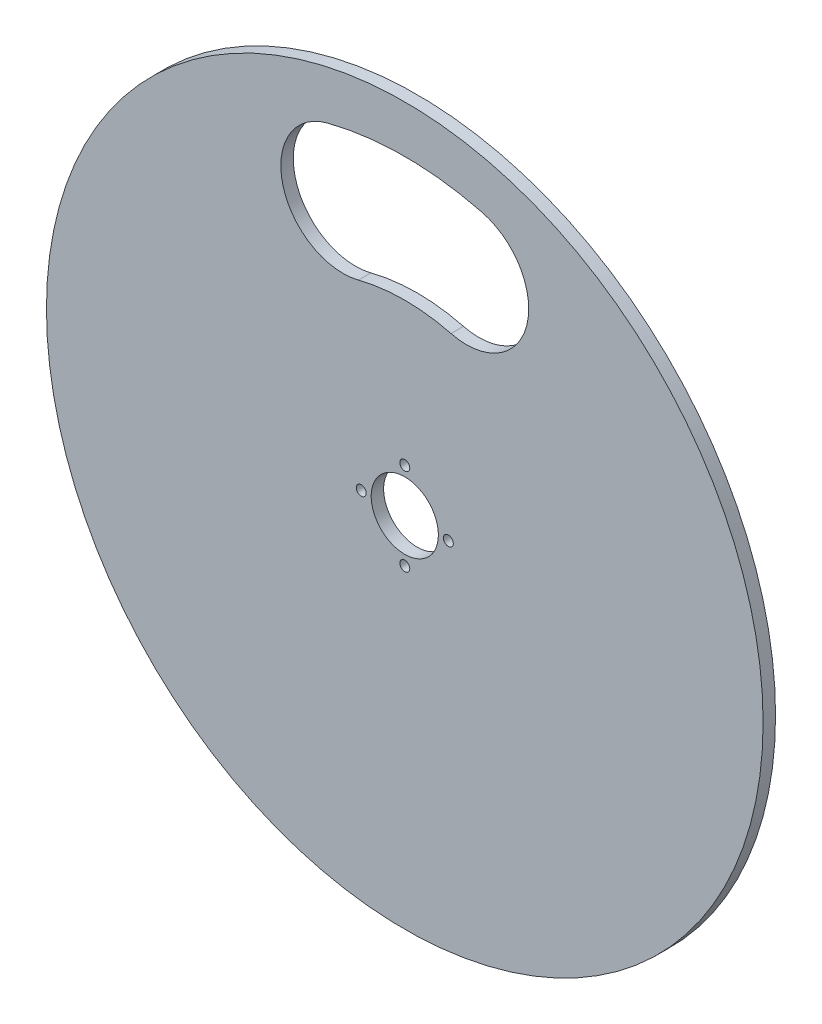
from build123d import *

# Parameters (mm, degrees)
EXTRUDE_1_DEPTH = 5


with BuildPart() as part:
    # 草图1 → 凸台-拉伸1 (new body)
    with BuildSketch(Plane.XY):
        with BuildLine():
            ThreePointArc((0, 144), (-144, 0), (0, -144))
            ThreePointArc((0, -144), (144, 0), (0, 144))
        make_face()
        with BuildLine():
            ThreePointArc((31.004898177, 121.09375), (0, 125), (-31.004898177, 121.09375))
            ThreePointArc((-31.004898177, 121.09375), (-49.607837082, 93.75), (-24.803918541, 71.875))
            ThreePointArc((-24.803918541, 71.875), (-21.678918541, 72.071081459), (-18.602938906, 72.65625))
            ThreePointArc((-18.602938906, 72.65625), (0, 75), (18.602938906, 72.65625))
            ThreePointArc((18.602938906, 72.65625), (21.678918541, 72.071081459), (24.803918541, 71.875))
            ThreePointArc((24.803918541, 71.875), (49.607837082, 93.75), (31.004898177, 121.09375))
        make_face(mode=Mode.SUBTRACT)
        with BuildLine():
            ThreePointArc((0, -13.5), (13.5, 0), (0, 13.5))
            ThreePointArc((0, 13.5), (-13.5, 0), (0, -13.5))
        make_face(mode=Mode.SUBTRACT)
        with BuildLine():
            ThreePointArc((17.5, -2), (19.5, 0), (17.5, 2))
            ThreePointArc((17.5, 2), (15.5, 0), (17.5, -2))
        make_face(mode=Mode.SUBTRACT)
        with BuildLine():
            ThreePointArc((0, -19.5), (2, -17.5), (0, -15.5))
            ThreePointArc((0, -15.5), (-2, -17.5), (0, -19.5))
        make_face(mode=Mode.SUBTRACT)
        with BuildLine():
            ThreePointArc((-17.5, -2), (-15.5, 0), (-17.5, 2))
            ThreePointArc((-17.5, 2), (-19.5, 0), (-17.5, -2))
        make_face(mode=Mode.SUBTRACT)
        with BuildLine():
            ThreePointArc((0, 15.5), (2, 17.5), (0, 19.5))
            ThreePointArc((0, 19.5), (-2, 17.5), (0, 15.5))
        make_face(mode=Mode.SUBTRACT)
    extrude(amount=EXTRUDE_1_DEPTH)


solid = part.part
